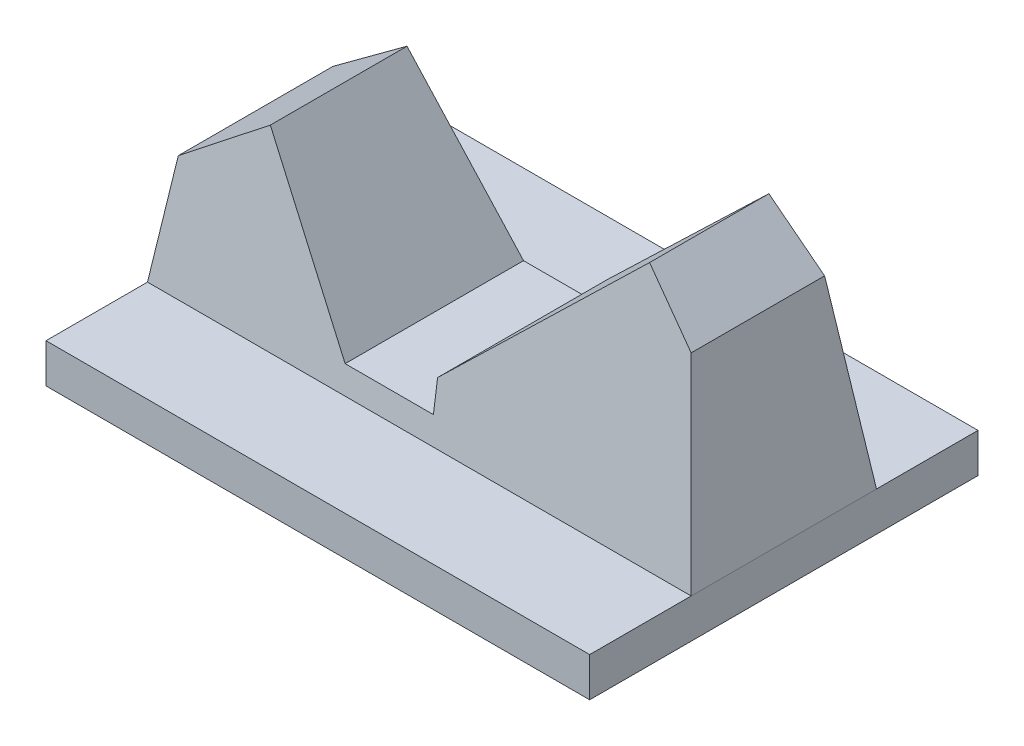
from build123d import *

# Parameters (mm, degrees)
SKETCH1_W           = 78.232
SKETCH1_H           = 55.88
BOSS_EXTRUDE1_DEPTH = 5.6388
SKETCH2_W           = 78.232
SKETCH2_H           = 26.67
BOSS_EXTRUDE2_DEPTH = 38.1
BOSS_EXTRUDE2_TAPER = 8
CUT_EXTRUDE1_DEPTH  = 19.05


with BuildPart() as part:
    # Sketch1 → Boss-Extrude1 (new body)
    with BuildSketch(Plane(origin=(0, 0, 0), x_dir=(1, 0, 0), z_dir=(0, 1, 0))):
        Rectangle(SKETCH1_W, SKETCH1_H)
    extrude(amount=BOSS_EXTRUDE1_DEPTH)

    # Sketch2 → Boss-Extrude2 (add)
    with BuildSketch(Plane(origin=(0, 5.6388, 0), x_dir=(1, 0, 0), z_dir=(0, 1, 0))):
        Rectangle(SKETCH2_W, SKETCH2_H)
    extrude(amount=BOSS_EXTRUDE2_DEPTH, taper=BOSS_EXTRUDE2_TAPER)

    # 3DSketch1 → Cut-Extrude1 (cut, symmetric)
    with BuildSketch(Plane(origin=(39.116, 28.335306521, -1e-09), x_dir=(-0.9811621581078611, 0.1931859712741186, 2.0390368677299597e-12), z_dir=(2.078300433678865e-12, 0, 1.0))):
        Polygon((0, 0), (12.678292519, -8.831750582), (34.020347529, 21.805529518), (33.186170505, 26.042187717), (45.646929913, 28.495649552), (63.27719365, 10.210852573), (75.090838988, 23.581993737), (79.734016802, 0), (2.975738849, -15.113324905), align=None)
    extrude(amount=CUT_EXTRUDE1_DEPTH, both=True, mode=Mode.SUBTRACT)


solid = part.part
